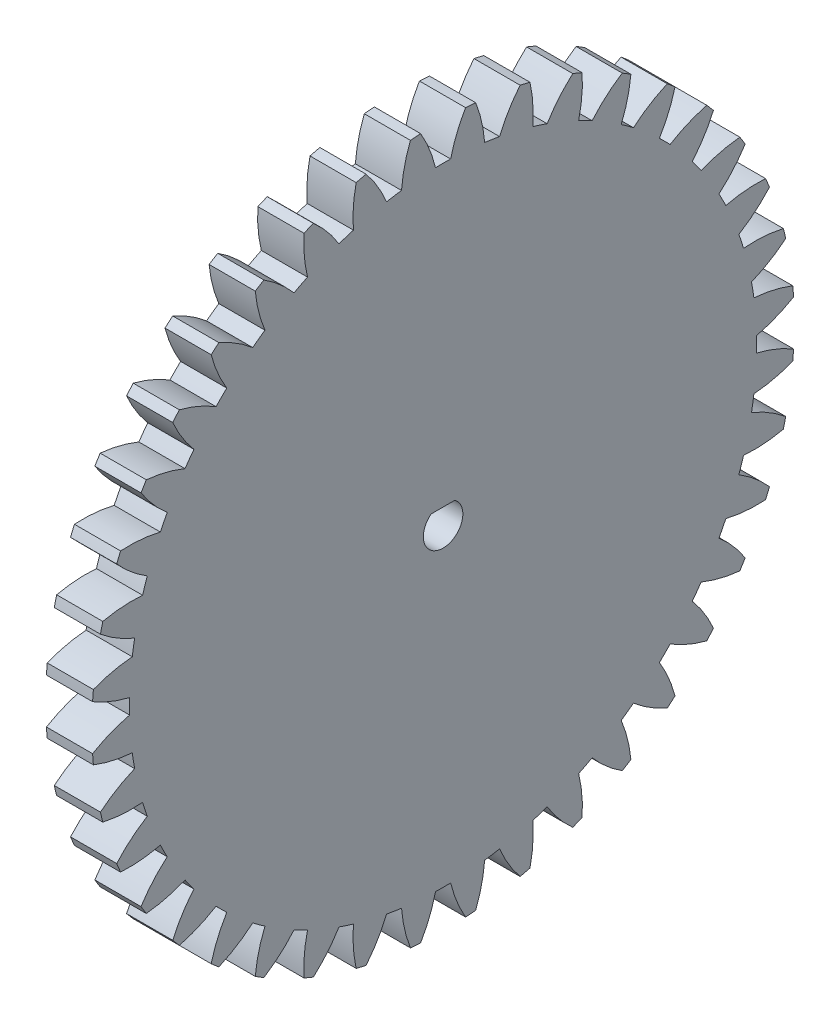
from build123d import *

# Parameters (mm, degrees)
BASPROSKE_W         = 5.842
BASPROSKE_H         = 44.45
TOOTHCUT_DEPTH      = 64.132669546
TEETHCUTS_COUNT     = 40
TEETHCUTS_ANGLE     = 351
BORSKE_R            = 2.38125
BORE_DEPTH          = 50.8000508
BOSS_EXTRUDE1_DEPTH = 5.842
SKETCH2_R           = 2.5
CUT_EXTRUDE1_DEPTH  = 64.004256733
BOSS_EXTRUDE2_DEPTH = 5.842


with BuildPart() as part:
    # BasProSke → Base-Revolve (revolve)
    with BuildSketch(Plane(origin=(0, 0, 0), x_dir=(1, 0, 0), z_dir=(0, 1, 0)), mode=Mode.PRIVATE) as base_revolve_sk:
        with Locations((2.921, 22.225)):
            Rectangle(BASPROSKE_W, BASPROSKE_H)
    revolve(base_revolve_sk.sketch.rotate(Axis((-10, 0, 0), (1, 0, 0)), 180), axis=Axis((-10, 0, 0), (1, 0, 0)))

    # TooCutSke → ToothCut (cut, through all)
    with BuildSketch(Plane(origin=(0, 0, 0), x_dir=(0, 0, -1), z_dir=(1, 0, 0))):
        with BuildLine():
            ThreePointArc((0.957950937, 39.674666749), (0, 39.68623), (-0.957950937, 39.674666749))
            ThreePointArc((-0.957950937, 39.674666749), (-1.731614599, 42.100719606), (-2.860326365, 44.383327255))
            ThreePointArc((-2.860326365, 44.383327255), (0, 44.4754), (2.860326365, 44.383327255))
            ThreePointArc((2.860326365, 44.383327255), (1.731614599, 42.100719606), (0.957950937, 39.674666749))
        make_face()
    toothcut = extrude(amount=TOOTHCUT_DEPTH, mode=Mode.SUBTRACT)

    # TeethCuts: ToothCut ×40 about axis
    teethcuts_axis = Axis((-10, 0, 0), (1, 0, 0))
    for i in range(1, TEETHCUTS_COUNT):
        add(toothcut.rotate(teethcuts_axis, i * TEETHCUTS_ANGLE / (TEETHCUTS_COUNT - 1)), mode=Mode.SUBTRACT)

    # BorSke → Bore (cut, symmetric)
    with BuildSketch(Plane(origin=(0, 0, 0), x_dir=(0, 0, -1), z_dir=(1, 0, 0))):
        with Locations(Location((0, 0, 0), (0, 0, 180))):
            Circle(BORSKE_R)
    extrude(amount=BORE_DEPTH, both=True, mode=Mode.SUBTRACT)

    # Sketch1 → Boss-Extrude1 (add)
    with BuildSketch(Plane(origin=(5.842, 0, 0), x_dir=(0, 0, -1), z_dir=(1, 0, 0))):
        with BuildLine():
            Line((-2.014311685, 1.27), (2.014311685, 1.27))
            ThreePointArc((2.014311685, 1.27), (0, 2.38125), (-2.014311685, 1.27))
        make_face()
        with BuildLine():
            Line((-2.014311685, -1.27), (2.014311685, -1.27))
            ThreePointArc((2.014311685, -1.27), (0, -2.38125), (-2.014311685, -1.27))
        make_face()
    extrude(amount=-BOSS_EXTRUDE1_DEPTH)

    # Sketch2 → Cut-Extrude1 (cut, through all)
    with BuildSketch(Plane.ZY):
        Circle(SKETCH2_R)
    extrude(amount=-CUT_EXTRUDE1_DEPTH, mode=Mode.SUBTRACT)

    # Sketch3 → Boss-Extrude2 (add)
    with BuildSketch(Plane.ZY):
        with BuildLine():
            Line((-1.5, 2), (1.5, 2))
            ThreePointArc((1.5, 2), (0, 2.5), (-1.5, 2))
        make_face()
    extrude(amount=-BOSS_EXTRUDE2_DEPTH)


solid = part.part
